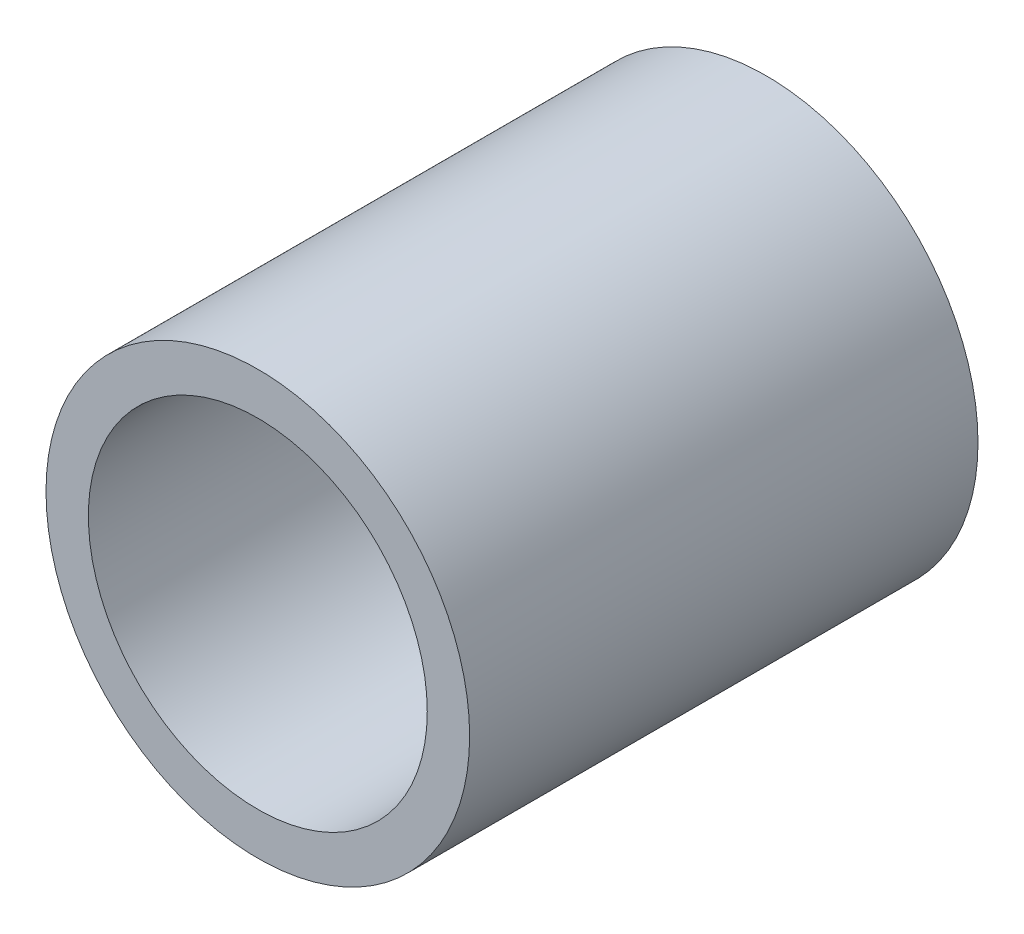
from build123d import *

# Parameters (mm, degrees)
CROQUIS1_W            = 19.05
CROQUIS1_H            = 7.9375
CORTAR_EXTRUIR2_REACH = 24.111
CROQUIS2_R            = 6.35


with BuildPart() as part:
    # Croquis1 → Revolución1 (revolve)
    with BuildSketch(Plane(origin=(0, 0, 0), x_dir=(0, 0, -1), z_dir=(1, 0, 0)), mode=Mode.PRIVATE) as revoluci_n1_sk:
        with Locations((9.525, 3.96875)):
            Rectangle(CROQUIS1_W, CROQUIS1_H)
    revolve(revoluci_n1_sk.sketch.rotate(Axis((0, 0, 0), (0, 0, -1)), 90), axis=Axis((0, 0, 0), (0, 0, -1)))

    # Croquis2 → Cortar-Extruir2 (cut, up to next)
    with BuildSketch(Plane.XY, mode=Mode.PRIVATE) as cortar_extruir2_sk1:
        Circle(CROQUIS2_R)
    cortar_extruir2_tool1 = extrude(cortar_extruir2_sk1.sketch, amount=-CORTAR_EXTRUIR2_REACH, mode=Mode.PRIVATE) & part.part
    add(cortar_extruir2_tool1.solids().sort_by_distance((0, 0, 0))[0], mode=Mode.SUBTRACT)


solid = part.part
